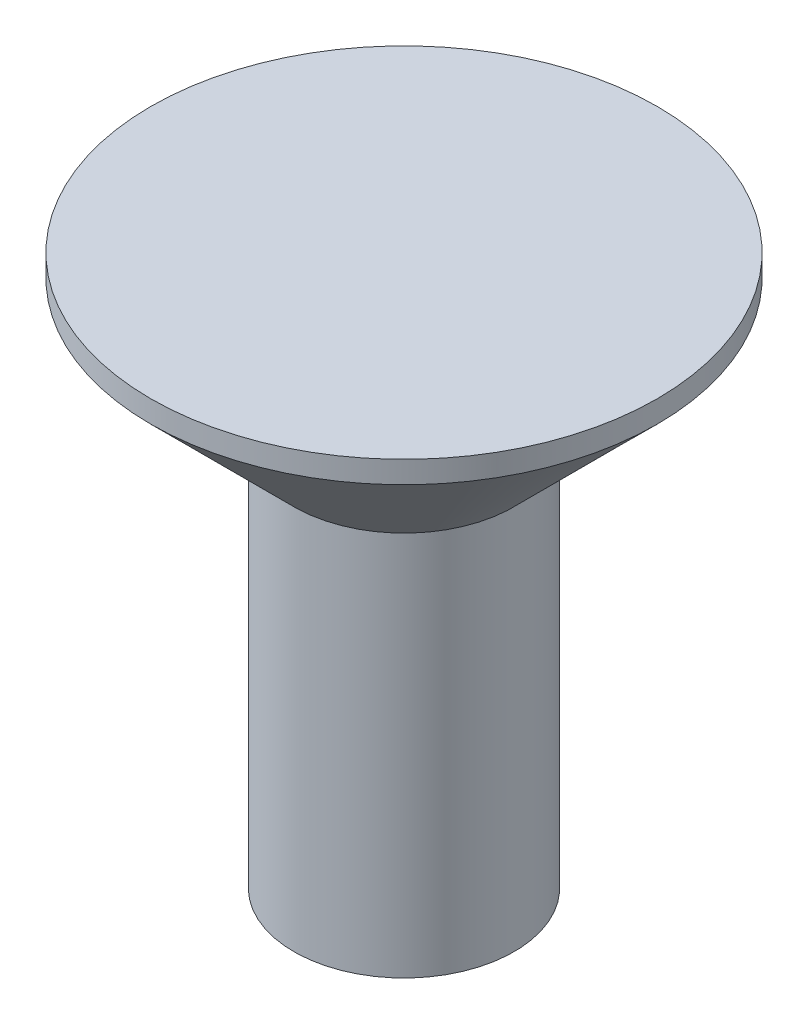
from build123d import *


with BuildPart() as part:
    # Sketch1 → Revolve1 (revolve)
    with BuildSketch(Plane.XY, mode=Mode.PRIVATE) as revolve1_sk:
        Polygon((0, 0), (12.7, 0), (12.7, 44.45), (29.21, 60.96), (29.21, 63.5), (0, 63.5), align=None)
    revolve(revolve1_sk.sketch.rotate(Axis((0, 63.5, 0), (0, -1, 0)), 180), axis=Axis((0, 63.5, 0), (0, -1, 0)))


solid = part.part
